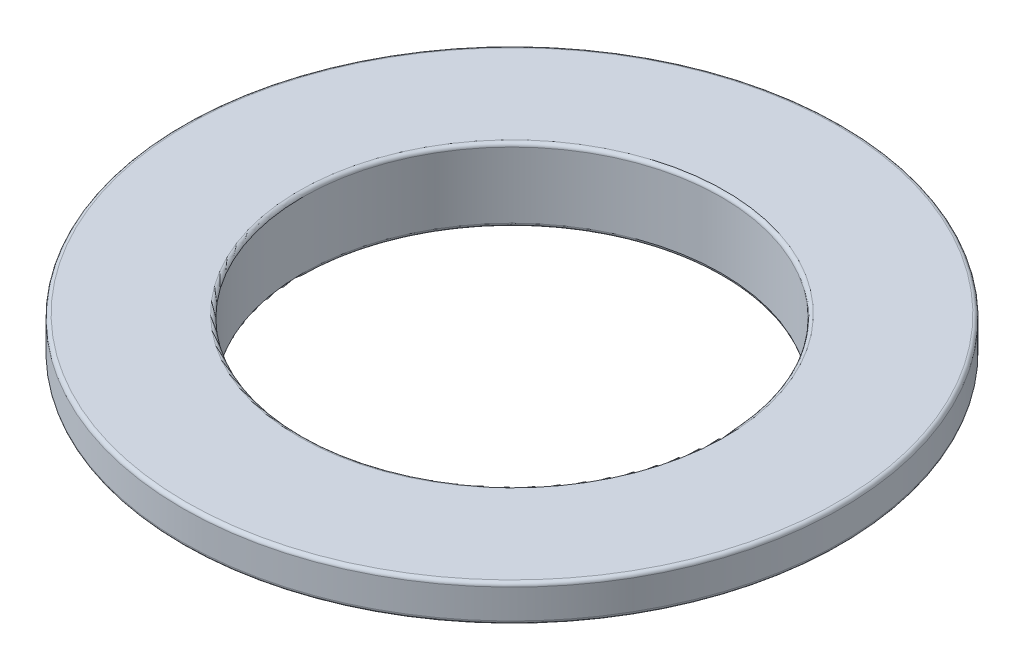
from build123d import *

# Parameters (mm, degrees)
FILLET1_R = 0.25


with BuildPart() as part:
    # Sketch1 → Revolve1 (revolve)
    with BuildSketch(Plane.XY, mode=Mode.PRIVATE) as revolve1_sk:
        with BuildLine():
            Line((16.8, 0), (14.3, 0))
            Line((14.3, 0), (14.3, 5))
            Line((14.3, 5), (22.5, 5))
            Line((22.5, 5), (22.5, 2.5))
            Line((22.5, 2.5), (18, 2.5))
            Line((18, 2.5), (18, 1.833030278))
            ThreePointArc((18, 1.833030278), (17.126679947, 1.095445115), (16.8, 0))
        make_face()
    revolve(revolve1_sk.sketch.rotate(Axis((0, 0, 0), (0, 1, 0)), 90), axis=Axis((0, 0, 0), (0, 1, 0)))

    # Fillet1
    fillet1_edges = [part.edges().sort_by_distance(p)[0] for p in [
        (0, 2.5, 18),
        (0, 1.833030278, 18),
        (0, 0, 16.8),
        (0, 0, 14.3),
        (0, 5, 14.3),
        (0, 5, 22.5),
        (0, 2.5, 22.5),
    ]]
    fillet(fillet1_edges, radius=FILLET1_R)


solid = part.part
